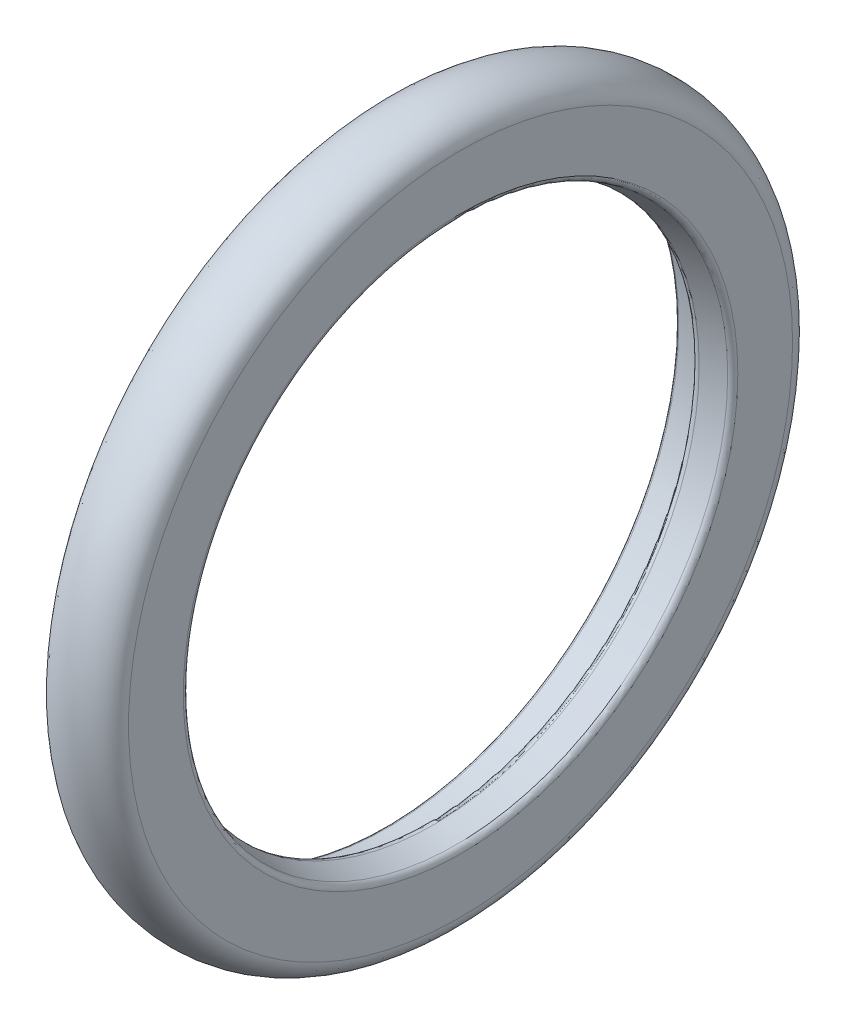
from build123d import *


with BuildPart() as part:
    # Sketch1 → Revolve1 (revolve)
    with BuildSketch(Plane(origin=(0, 0, 0), x_dir=(1, 0, 0), z_dir=(0, 1, 0))):
        with BuildLine():
            Line((-3.175, 28), (-3.175, 24.75))
            ThreePointArc((-3.175, 24.75), (-3.101776695, 24.573223305), (-2.925, 24.5))
            Line((-2.925, 24.5), (-0.558663494, 24.5))
            ThreePointArc((-0.558663494, 24.5), (-0.254282779, 24.39667667), (-0.075700581, 24.129409523))
            Line((-0.075700581, 24.129409523), (0.294997926, 22.74594386))
            ThreePointArc((0.294997926, 22.74594386), (0.527960839, 22.442340681), (0.907370362, 22.39239047))
            Line((0.907370362, 22.39239047), (2.804409523, 22.900700581))
            ThreePointArc((2.804409523, 22.900700581), (3.07167667, 23.079282779), (3.175, 23.383663494))
            Line((3.175, 23.383663494), (3.175, 28))
            add(Edge.make_bspline(
                [(3.175, 28), (3.175, 30), (0, 30), (-3.175, 30), (-3.175, 28)],
                knots=[0, 0, 0, 1.570796327, 1.570796327, 3.141592654, 3.141592654, 3.141592654], degree=2, weights=[1, 0.707106781, 1, 0.707106781, 1]))
        make_face()
    revolve(axis=Axis((88.99, 0, 0), (-1, 0, 0)))


solid = part.part
